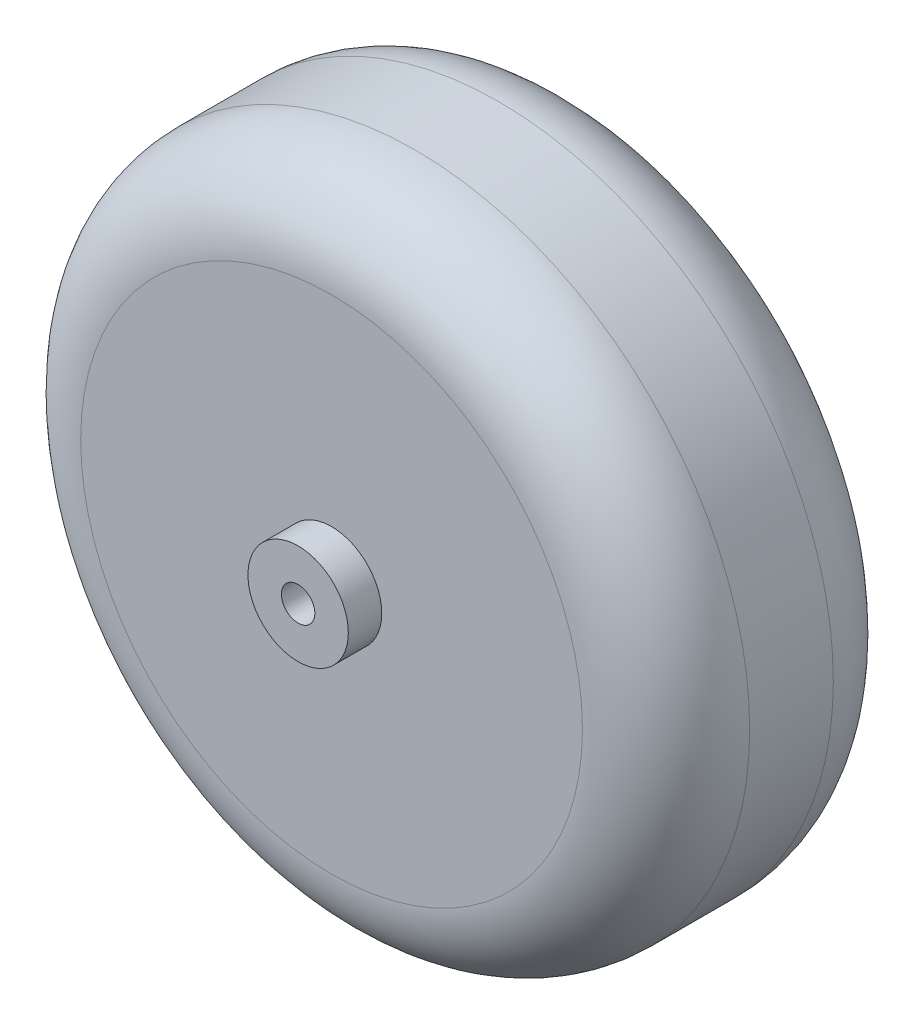
from build123d import *

# Parameters (mm, degrees)
SKETCH1_R           = 20
BOSS_EXTRUDE1_DEPTH = 7.5
FILLET2_R           = 5
SKETCH2_R           = 3
BOSS_EXTRUDE2_DEPTH = 2
SKETCH3_R           = 1
CUT_EXTRUDE1_DEPTH  = 35.073450133


with BuildPart() as part:
    # Sketch1 → Boss-Extrude1 (new, symmetric)
    with BuildSketch(Plane.XY):
        Circle(SKETCH1_R)
    extrude(amount=BOSS_EXTRUDE1_DEPTH, both=True)

    # Fillet2
    fillet2_edges = [part.edges().sort_by_distance(p)[0] for p in [
        (-20, 0, -7.5),
        (-20, 0, 7.5),
    ]]
    fillet(fillet2_edges, radius=FILLET2_R)

    # Sketch2 → Boss-Extrude2 (add)
    with BuildSketch(Plane.XY.offset(7.5)):
        Circle(SKETCH2_R)
    boss_extrude2 = extrude(amount=BOSS_EXTRUDE2_DEPTH)

    # Mirror3: Boss-Extrude2 across plane
    add(boss_extrude2.mirror(Plane.XY))

    # Sketch3 → Cut-Extrude1 (cut, through all)
    with BuildSketch(Plane.XY.offset(9.5)):
        Circle(SKETCH3_R)
    extrude(amount=-CUT_EXTRUDE1_DEPTH, mode=Mode.SUBTRACT)


solid = part.part
